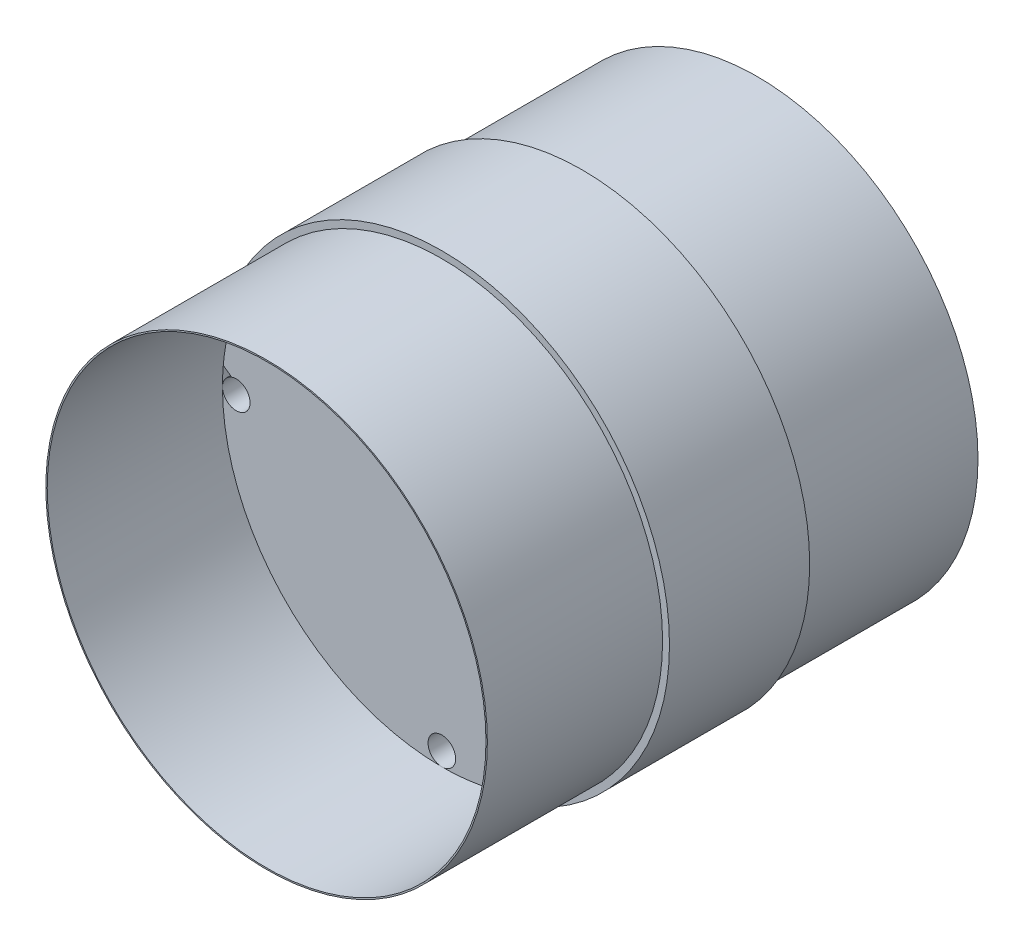
from build123d import *

# Parameters (mm, degrees)
SKETCH1_R           = 82.5
BOSS_EXTRUDE2_DEPTH = 50.8
SKETCH2_R           = 80
BOSS_EXTRUDE3_DEPTH = 63.5
BOSS_EXTRUDE4_START = -63.5
SKETCH3_R           = 80
BOSS_EXTRUDE4_DEPTH = 63.5
SKETCH7_R           = 79.5
CUT_EXTRUDE1_DEPTH  = 63.5
CUT_EXTRUDE2_START  = 63.5
SKETCH8_R           = 79.5
CUT_EXTRUDE2_DEPTH  = 63.5
SKETCH10_R          = 5
CUT_EXTRUDE3_DEPTH  = 63.5


with BuildPart() as part:
    # Sketch1 → Boss-Extrude2 (new body)
    with BuildSketch(Plane.XY):
        Circle(SKETCH1_R)
    extrude(amount=BOSS_EXTRUDE2_DEPTH)

    # Sketch2 → Boss-Extrude3 (add)
    with BuildSketch(Plane.XY.offset(50.8)):
        Circle(SKETCH2_R)
    extrude(amount=BOSS_EXTRUDE3_DEPTH)

    # Sketch3 → Boss-Extrude4 (add)
    with BuildSketch(Plane.XY.offset(BOSS_EXTRUDE4_START)):
        Circle(SKETCH3_R)
    extrude(amount=BOSS_EXTRUDE4_DEPTH)

    # Sketch7 → Cut-Extrude1 (cut)
    with BuildSketch(Plane.XY.offset(114.3)):
        Circle(SKETCH7_R)
    extrude(amount=-CUT_EXTRUDE1_DEPTH, mode=Mode.SUBTRACT)

    # Sketch8 → Cut-Extrude2 (cut)
    with BuildSketch(Plane.XY.offset(-63.5).offset(CUT_EXTRUDE2_START)):
        Circle(SKETCH8_R)
    extrude(amount=-CUT_EXTRUDE2_DEPTH, mode=Mode.SUBTRACT)

    # Sketch10 → Cut-Extrude3 (cut)
    with BuildSketch(Plane.XY.offset(50.8)):
        with Locations(Location((0, 74.5, 0), (0, 0, 90.000374339))):
            Circle(SKETCH10_R)
        with Locations(Location((74.5, 0, 0), (0, 0, 0.000381298))):
            Circle(SKETCH10_R)
        with Locations(Location((0, -74.5, 0), (0, 0, 270.000382713))):
            Circle(SKETCH10_R)
        with Locations(Location((-74.5, 0, 0), (0, 0, 179.999623258))):
            Circle(SKETCH10_R)
    extrude(amount=-CUT_EXTRUDE3_DEPTH, mode=Mode.SUBTRACT)


with BuildPart() as cut_extrude3_kept_piece:
    # of the separate pieces the step leaves, the one the design keeps (cut_extrude3_pieces_kept)
    add(part.part.solids().sort_by_distance((82.5, 0, 50.8))[0])


solid = cut_extrude3_kept_piece.part
